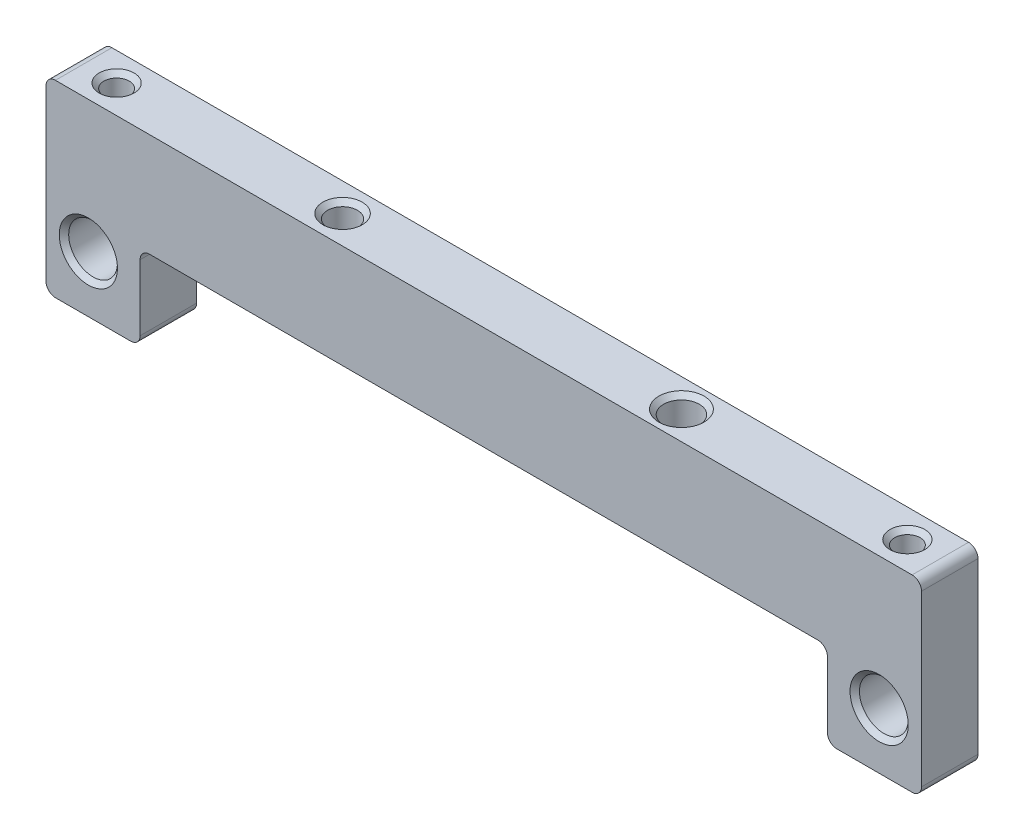
from build123d import *

# Parameters (mm, degrees)
SKETCH1_W                    = 93
SKETCH1_H                    = 20
BOSS_EXTRUDE1_DEPTH          = 6
CUT_EXTRUDE1_REACH           = 49.94
SKETCH2_W                    = 73
SKETCH2_H                    = 9
F_6_0_204_DIAMETER_HOLE1_D   = 5.1816
F_6_CLEARANCE_HOLE1_D        = 3.7973
F_6_32_TAPPED_HOLE1_REACH    = 52.973
F_6_32_TAPPED_HOLE1_BORE_R   = 1.35255
F_1_8_0_125_DIAMETER_HOLE1_D = 3.175
FILLET1_R                    = 1
CHAMFER1_SIZE                = 0.5


with BuildPart() as part:
    # Sketch1 → Boss-Extrude1 (new body)
    with BuildSketch(Plane.XY):
        Rectangle(SKETCH1_W, SKETCH1_H)
    extrude(amount=BOSS_EXTRUDE1_DEPTH)

    # Sketch2 → Cut-Extrude1 (cut, up to next)
    with BuildSketch(Plane.XY.offset(6), mode=Mode.PRIVATE) as cut_extrude1_sk1:
        with Locations((0, -5.5)):
            Rectangle(SKETCH2_W, SKETCH2_H)
    cut_extrude1_tool1 = extrude(cut_extrude1_sk1.sketch, amount=-CUT_EXTRUDE1_REACH, mode=Mode.PRIVATE) & part.part
    add(cut_extrude1_tool1.solids().sort_by_distance((0, -5.5, 6))[0], mode=Mode.SUBTRACT)

    # #6 (0.204) Diameter Hole1 (through all)
    with Locations(Plane.XY.offset(6)):
        with Locations((42, -4), (-42, -4)):
            Hole(F_6_0_204_DIAMETER_HOLE1_D / 2)

    # #6 Clearance Hole1 (through all)
    with Locations(Plane(origin=(0, 10, 0), x_dir=(1, 0, 0), z_dir=(0, 1, 0))):
        with Locations((18, -3)):
            Hole(F_6_CLEARANCE_HOLE1_D / 2)

    # #6-32 Tapped Hole1 bore → #6-32 Tapped Hole1 (cut, up to next)
    with BuildSketch(Plane(origin=(0, 10, 0), x_dir=(1, 0, 0), z_dir=(0, 1, 0)), mode=Mode.PRIVATE) as f_6_32_tapped_hole1_sk1:
        with Locations((-42, -3)):
            Circle(F_6_32_TAPPED_HOLE1_BORE_R)
    f_6_32_tapped_hole1_tool1 = extrude(f_6_32_tapped_hole1_sk1.sketch, amount=-F_6_32_TAPPED_HOLE1_REACH, mode=Mode.PRIVATE) & part.part
    # #6-32 Tapped Hole1 bore → #6-32 Tapped Hole1 (cut, up to next)
    with BuildSketch(Plane(origin=(0, 10, 0), x_dir=(1, 0, 0), z_dir=(0, 1, 0)), mode=Mode.PRIVATE) as f_6_32_tapped_hole1_sk2:
        with Locations((42, -3)):
            Circle(F_6_32_TAPPED_HOLE1_BORE_R)
    f_6_32_tapped_hole1_tool2 = extrude(f_6_32_tapped_hole1_sk2.sketch, amount=-F_6_32_TAPPED_HOLE1_REACH, mode=Mode.PRIVATE) & part.part
    add(f_6_32_tapped_hole1_tool1.solids().sort_by_distance((-42, 10, 3))[0], mode=Mode.SUBTRACT)
    add(f_6_32_tapped_hole1_tool2.solids().sort_by_distance((42, 10, 3))[0], mode=Mode.SUBTRACT)

    # 1/8 (0.125) Diameter Hole1 (through all)
    with Locations(Plane(origin=(0, 10, 0), x_dir=(1, 0, 0), z_dir=(0, 1, 0))):
        with Locations((-18, -3)):
            Hole(F_1_8_0_125_DIAMETER_HOLE1_D / 2)

    # Fillet1
    fillet1_edges = [part.edges().sort_by_distance(p)[0] for p in [
        (-36.5, -10, 3),
        (-36.5, -1, 3),
        (36.5, -1, 3),
        (36.5, -10, 3),
        (46.5, -10, 3),
        (-46.5, -10, 3),
        (-46.5, 10, 3),
        (46.5, 10, 3),
    ]]
    fillet(fillet1_edges, radius=FILLET1_R)

    # Chamfer1
    chamfer1_edges = [part.edges().sort_by_distance(p)[0] for p in [
        (44.5908, -4, 6),
        (44.5908, -4, 0),
        (-39.4092, -4, 6),
        (-39.4092, -4, 0),
        (19.89865, 10, 3),
        (19.89865, -1, 3),
        (40.64745, 10, 3),
        (-43.35255, 10, 3),
        (-16.4125, 10, 3),
        (-16.4125, -1, 3),
    ]]
    chamfer(chamfer1_edges, length=CHAMFER1_SIZE)


solid = part.part
